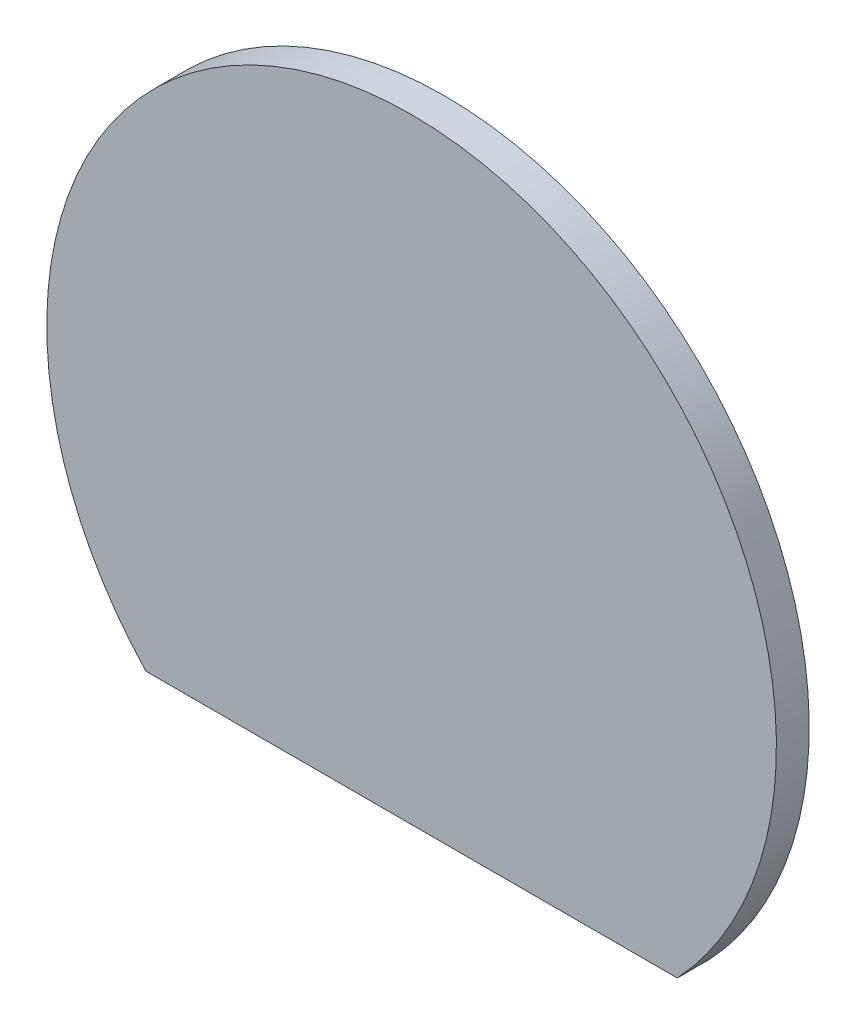
from build123d import *

# Parameters (mm, degrees)
BOSS_EXTRU_1_CONTOUR_DEPTH = 1.6


with BuildPart() as part:
    # Contour → Boss.-Extru.1_Contour (new body)
    with BuildSketch(Plane.XY):
        with BuildLine():
            Line((-12.961481397, -12.2), (12.961481397, -12.2))
            ThreePointArc((12.961481397, -12.2), (0, 17.8), (-12.961481397, -12.2))
        make_face()
    extrude(amount=BOSS_EXTRU_1_CONTOUR_DEPTH)


solid = part.part
